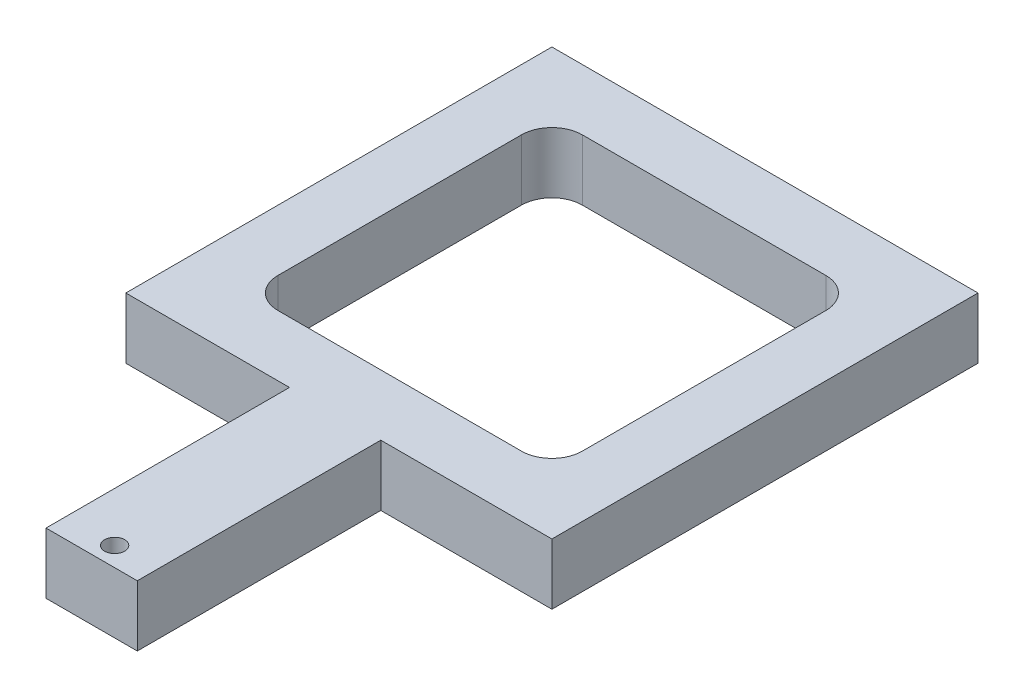
from build123d import *

# Parameters (mm, degrees)
EXTRUDE_1_DEPTH     = 10
SKETCH_2_R          = 1.646034056
CUT_EXTRUDE_1_DEPTH = 84.366660003


with BuildPart() as part:
    # 草图1 → 凸台-拉伸1 (new body)
    with BuildSketch(Plane(origin=(0, 0, 0), x_dir=(1, 0, 0), z_dir=(0, 1, 0))):
        Polygon((-8.112254188, -35), (-8.112254188, -75), (6.887745812, -75), (6.887745812, -35), (35, -35), (35, 35), (-35, 35), (-35, -35), align=None)
        with BuildLine():
            Line((-20, 25), (20, 25))
            ThreePointArc((20, 25), (23.535533906, 23.535533906), (25, 20))
            Line((25, 20), (25, -20))
            ThreePointArc((25, -20), (23.535533906, -23.535533906), (20, -25))
            Line((20, -25), (-20, -25))
            ThreePointArc((-20, -25), (-23.535533906, -23.535533906), (-25, -20))
            Line((-25, -20), (-25, 20))
            ThreePointArc((-25, 20), (-23.535533906, 23.535533906), (-20, 25))
        make_face(mode=Mode.SUBTRACT)
    extrude(amount=EXTRUDE_1_DEPTH)

    # 草图2 → 切除-拉伸1 (cut, through all)
    with BuildSketch(Plane(origin=(0, 10, 0), x_dir=(1, 0, 0), z_dir=(0, 1, 0))):
        with Locations(Location((0, -71.838140911, 0), (0, 0, 270))):
            Circle(SKETCH_2_R)
    extrude(amount=-CUT_EXTRUDE_1_DEPTH, mode=Mode.SUBTRACT)


solid = part.part
